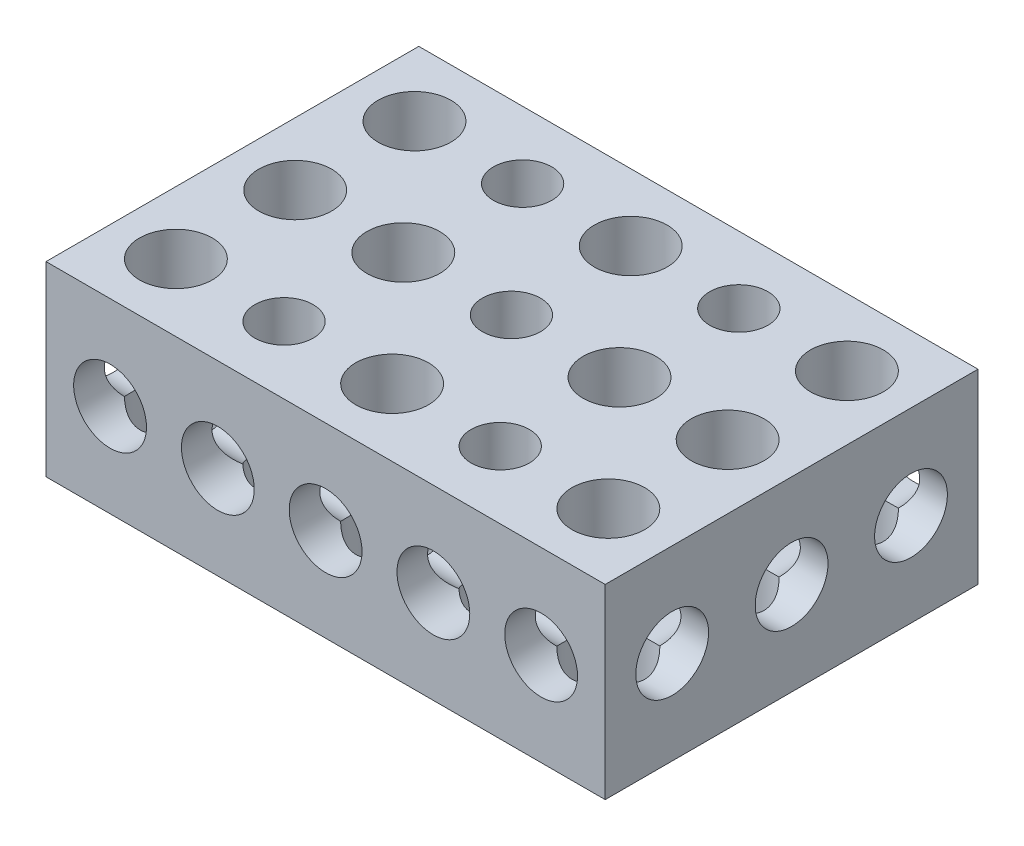
from build123d import *

# Parameters (mm, degrees)
SKETCH1_W               = 76.2
SKETCH1_H               = 25.4
SKETCH1_R               = 4.9609375
BOSS_EXTRUDE1_DEPTH     = 50.8
SKETCH3_R               = 4.9609375
CUT_EXTRUDE2_DEPTH      = 96.038097624
F_3_8_16_TAPPED_HOLE1_D = 7.9375
CUT_EXTRUDE4_REACH      = 97.038
SKETCH2_R               = 4.9609375


with BuildPart() as part:
    # Sketch1 → Boss-Extrude1 (new body)
    with BuildSketch(Plane.XY):
        with Locations((-38.1, 12.7)):
            Rectangle(SKETCH1_W, SKETCH1_H)
        with Locations((-67.46875, 12.7)):
            Circle(SKETCH1_R, mode=Mode.SUBTRACT)
        with Locations((-52.784375, 12.7)):
            Circle(SKETCH1_R, mode=Mode.SUBTRACT)
        with Locations((-38.1, 12.7)):
            Circle(SKETCH1_R, mode=Mode.SUBTRACT)
        with Locations((-23.415625, 12.7)):
            Circle(SKETCH1_R, mode=Mode.SUBTRACT)
        with Locations((-8.73125, 12.7)):
            Circle(SKETCH1_R, mode=Mode.SUBTRACT)
    extrude(amount=-BOSS_EXTRUDE1_DEPTH)

    # Sketch3 → Cut-Extrude2 (cut, through all)
    with BuildSketch(Plane(origin=(0, 25.4, 0), x_dir=(1, 0, 0), z_dir=(0, 1, 0))):
        with Locations(Location((-8.73125, 41.671875, 0), (0, 0, 180))):
            Circle(SKETCH3_R)
        with Locations(Location((-67.65925, 41.671875, 0), (0, 0, 180))):
            Circle(SKETCH3_R)
        with Locations(Location((-67.65925, 25.415875, 0), (0, 0, 180))):
            Circle(SKETCH3_R)
        with Locations(Location((-67.65925, 9.159875, 0), (0, 0, 180))):
            Circle(SKETCH3_R)
        with Locations(Location((-8.73125, 25.415875, 0), (0, 0, 180))):
            Circle(SKETCH3_R)
        with Locations(Location((-8.73125, 9.159875, 0), (0, 0, 180))):
            Circle(SKETCH3_R)
        with Locations(Location((-38.19525, 41.671875, 0), (0, 0, 180))):
            Circle(SKETCH3_R)
        with Locations(Location((-23.46325, 25.415875, 0), (0, 0, 180))):
            Circle(SKETCH3_R)
        with Locations(Location((-52.92725, 25.415875, 0), (0, 0, 180))):
            Circle(SKETCH3_R)
        with Locations(Location((-38.19525, 9.159875, 0), (0, 0, 180))):
            Circle(SKETCH3_R)
    extrude(amount=-CUT_EXTRUDE2_DEPTH, mode=Mode.SUBTRACT)

    # 3/8-16 Tapped Hole1 (through all)
    with Locations(Plane(origin=(0, 25.4, 0), x_dir=(1, 0, 0), z_dir=(0, 1, 0))):
        with Locations((-23.46325, 41.671875), (-23.46325, 9.159875), (-38.19525, 25.415875), (-52.92725, 41.671875), (-52.92725, 9.159875)):
            Hole(F_3_8_16_TAPPED_HOLE1_D / 2)

    # Cut-Extrude4: up to this face of the body (flat: up to its plane)
    cut_extrude4_end = Plane(part.part.faces().sort_by_distance((-76.2, 12.7, -25.4))[0])
    # Sketch2 → Cut-Extrude4 (cut, up to the picked face)
    with BuildSketch(Plane(origin=(0, 0, 0), x_dir=(0, 0, -1), z_dir=(1, 0, 0)), mode=Mode.PRIVATE) as cut_extrude4_sk1:
        with Locations(Location((25.4, 12.7, 0), (0, 0, 313.957644639))):
            Circle(SKETCH2_R)
    cut_extrude4_tool1 = split(extrude(cut_extrude4_sk1.sketch, amount=-CUT_EXTRUDE4_REACH, mode=Mode.PRIVATE), bisect_by=cut_extrude4_end, keep=Keep.BOTH, mode=Mode.PRIVATE)
    # Sketch2 → Cut-Extrude4 (cut, up to the picked face)
    with BuildSketch(Plane(origin=(0, 0, 0), x_dir=(0, 0, -1), z_dir=(1, 0, 0)), mode=Mode.PRIVATE) as cut_extrude4_sk2:
        with Locations((41.671875, 12.7)):
            Circle(SKETCH2_R)
    cut_extrude4_tool2 = split(extrude(cut_extrude4_sk2.sketch, amount=-CUT_EXTRUDE4_REACH, mode=Mode.PRIVATE), bisect_by=cut_extrude4_end, keep=Keep.BOTH, mode=Mode.PRIVATE)
    # Sketch2 → Cut-Extrude4 (cut, up to the picked face)
    with BuildSketch(Plane(origin=(0, 0, 0), x_dir=(0, 0, -1), z_dir=(1, 0, 0)), mode=Mode.PRIVATE) as cut_extrude4_sk3:
        with Locations(Location((9.128125, 12.7, 0), (0, 0, 314.474436275))):
            Circle(SKETCH2_R)
    cut_extrude4_tool3 = split(extrude(cut_extrude4_sk3.sketch, amount=-CUT_EXTRUDE4_REACH, mode=Mode.PRIVATE), bisect_by=cut_extrude4_end, keep=Keep.BOTH, mode=Mode.PRIVATE)
    add(cut_extrude4_tool1.solids().sort_by(Axis((0, 12.7, -25.4), (-1, 0, 0)))[0], mode=Mode.SUBTRACT)
    add(cut_extrude4_tool2.solids().sort_by(Axis((0, 12.7, -41.671875), (-1, 0, 0)))[0], mode=Mode.SUBTRACT)
    add(cut_extrude4_tool3.solids().sort_by(Axis((0, 12.7, -9.128125), (-1, 0, 0)))[0], mode=Mode.SUBTRACT)


solid = part.part
